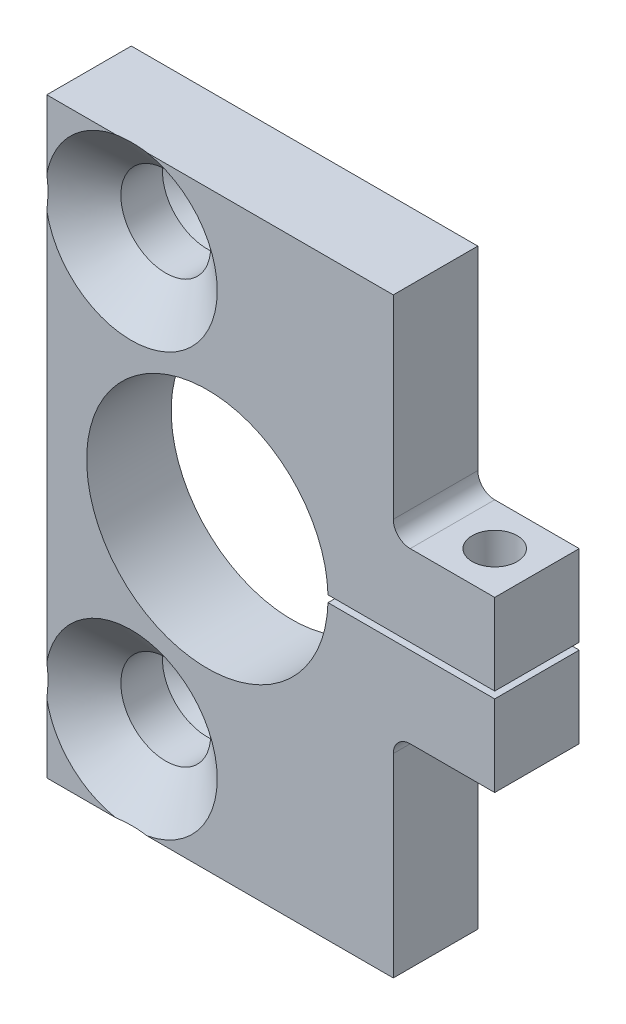
from build123d import *

# Parameters (mm, degrees)
SKETCH1_W               = 67.31
SKETCH1_H               = 88.9
EXTRUDE1_DEPTH          = 12.7
SKETCH2_R               = 18.1356
EXTRUDE2_DEPTH          = 58.181741185
SKETCH3_W               = 28.468633454
SKETCH3_H               = 1.016
EXTRUDE3_DEPTH          = 58.181741185
F_1_4_CLEARANCE_HOLE1_D = 6.7564
SKETCH10_W              = 15.24
SKETCH10_H              = 31.75
EXTRUDE4_DEPTH          = 58.181741185
FILLET1_R               = 2.54
FILLET1_OF_MIRROR2_R    = 2.54


with BuildPart() as part:
    # Sketch1 → Extrude1 (new body)
    with BuildSketch(Plane.XY):
        Rectangle(SKETCH1_W, SKETCH1_H)
    extrude(amount=EXTRUDE1_DEPTH)

    # Sketch2 → Extrude2 (cut, through all)
    with BuildSketch(Plane.XY.offset(12.7)):
        with Locations((-9.525, 0)):
            Circle(SKETCH2_R)
    extrude(amount=-EXTRUDE2_DEPTH, mode=Mode.SUBTRACT)

    # Sketch3 → Extrude3 (cut, through all)
    with BuildSketch(Plane.XY.offset(12.7)):
        with Locations((21.1328, 0)):
            Rectangle(SKETCH3_W, SKETCH3_H)
    extrude(amount=-EXTRUDE3_DEPTH, mode=Mode.SUBTRACT)

    # 1/4 Clearance Hole1 (through all)
    with Locations(Plane(origin=(27.305, 44.45, 6.35), x_dir=(0, 0, 1), z_dir=(0, 1, 0))):
        with Locations((0, 0)):
            Hole(F_1_4_CLEARANCE_HOLE1_D / 2)

    # Sketch9 → CSK for 1/2 Flat Head Machine Screw (100)1 (revolve, cut)
    with BuildSketch(Plane(origin=(-20.955, 31.75, 12.7), x_dir=(0, -1, 0), z_dir=(1, 0, 0))):
        Polygon((0, 0), (0, 15.483549943), (6.74624, 11.43), (6.74624, 5.17695943), (12.9159, 0), align=None)
    csk_for_1_2_flat_head_machine_screw_100 = revolve(axis=Axis((-20.955, 31.75, 19.05), (0, 0, -1)), mode=Mode.SUBTRACT)

    # Mirror1: CSK for 1/2 Flat Head Machine Screw (100)1 across plane
    add(csk_for_1_2_flat_head_machine_screw_100.mirror(Plane.ZX), mode=Mode.SUBTRACT)

    # Sketch10 → Extrude4 (cut, through all)
    with BuildSketch(Plane.XY.offset(12.7)):
        with Locations((26.035, 28.575)):
            Rectangle(SKETCH10_W, SKETCH10_H)
    extrude4 = extrude(amount=-EXTRUDE4_DEPTH, mode=Mode.SUBTRACT)

    # Fillet1
    fillet1_edges = [part.edges().sort_by_distance(p)[0] for p in [
        (18.415, 12.7, 6.35),
    ]]
    fillet(fillet1_edges, radius=FILLET1_R)

    # Mirror2: Extrude4 across plane
    add(extrude4.mirror(Plane.ZX), mode=Mode.SUBTRACT)

    # Fillet1 of Mirror2
    fillet1_of_mirror2_edges = [part.edges().sort_by_distance(p)[0] for p in [
        (18.415, -12.7, 6.35),
    ]]
    fillet(fillet1_of_mirror2_edges, radius=FILLET1_OF_MIRROR2_R)


solid = part.part
